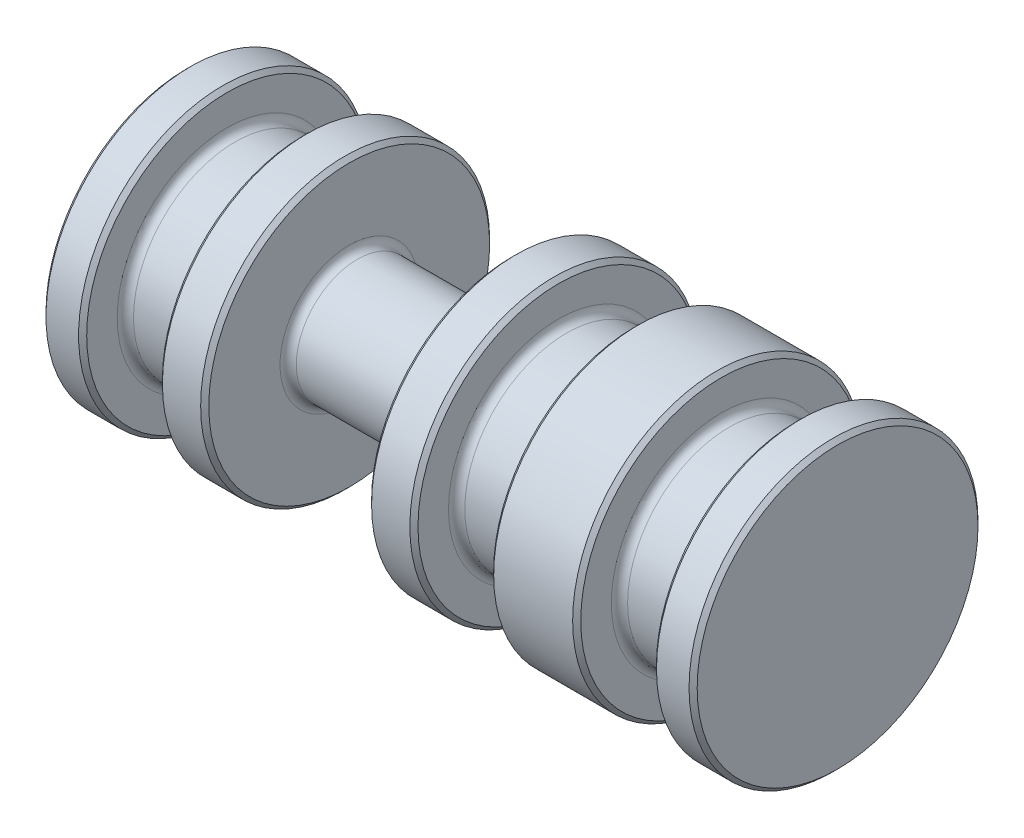
from build123d import *

# Parameters (mm, degrees)
SKETCH1_R           = 4.5085
BOSS_EXTRUDE1_DEPTH = 20.32
SKETCH2_W           = 2.3622
SKETCH2_H           = 1.3335
SKETCH2_W_2         = 5.08
SKETCH2_H_2         = 2.6035
FILLET1_R           = 0.254
CHAMFER1_SIZE       = 0.127
CHAMFER2_SIZE       = 0.127


with BuildPart() as part:
    # Sketch1 → Boss-Extrude1 (new body)
    with BuildSketch(Plane(origin=(0, 0, 0), x_dir=(0, 0, -1), z_dir=(1, 0, 0))):
        Circle(SKETCH1_R)
    extrude(amount=BOSS_EXTRUDE1_DEPTH)

    # Sketch2 → Cut-Revolve1 (revolve, cut)
    with BuildSketch(Plane.XY, mode=Mode.PRIVATE) as cut_revolve1_sk:
        with Locations((2.4511, 3.84175)):
            Rectangle(SKETCH2_W, SKETCH2_H)
        with Locations((17.8689, 3.84175)):
            Rectangle(SKETCH2_W, SKETCH2_H)
        with Locations((12.7889, 3.84175)):
            Rectangle(SKETCH2_W, SKETCH2_H)
        with Locations((7.62, 3.20675)):
            Rectangle(SKETCH2_W_2, SKETCH2_H_2)
    revolve(cut_revolve1_sk.sketch.rotate(Axis((-1.617419624, 0, 0), (1, 0, 0)), 90), axis=Axis((-1.617419624, 0, 0), (1, 0, 0)), mode=Mode.SUBTRACT)

    # Fillet1
    fillet1_edges = [part.edges().sort_by_distance(p)[0] for p in [
        (3.6322, 0, -3.175),
        (1.27, 0, -3.175),
        (19.05, 0, -3.175),
        (16.6878, 0, -3.175),
        (13.97, 0, -3.175),
        (11.6078, 0, -3.175),
        (5.08, 0, -1.905),
        (10.16, 0, -1.905),
    ]]
    fillet(fillet1_edges, radius=FILLET1_R)

    # Chamfer1
    chamfer1_edges = [part.edges().sort_by_distance(p)[0] for p in [
        (3.6322, 0, 4.5085),
        (19.05, 0, 4.5085),
        (13.97, 0, 4.5085),
        (10.16, 0, 4.5085),
        (0, 0, 4.5085),
    ]]
    chamfer(chamfer1_edges, length=CHAMFER1_SIZE)

    # Chamfer2
    chamfer2_edges = [part.edges().sort_by_distance(p)[0] for p in [
        (1.27, 0, 4.5085),
        (16.6878, 0, 4.5085),
        (11.6078, 0, 4.5085),
        (5.08, 0, 4.5085),
        (20.32, 0, 4.5085),
    ]]
    chamfer(chamfer2_edges, length=CHAMFER2_SIZE)


solid = part.part
